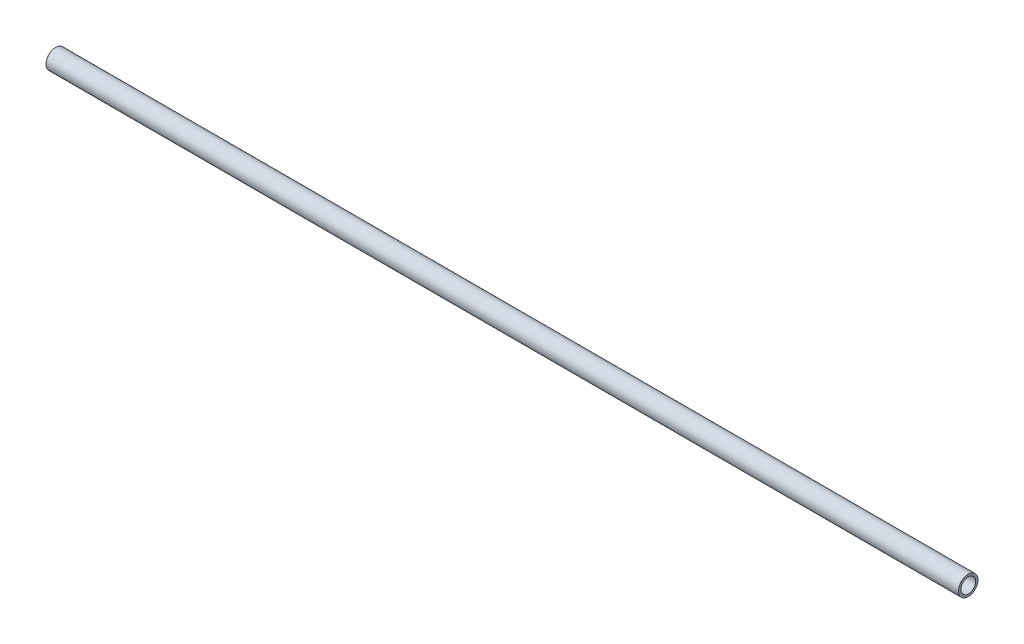
from build123d import *

# Parameters (mm, degrees)
SKETCH1_R           = 12.7
SKETCH1_R_2         = 9.652
BOSS_EXTRUDE1_DEPTH = 1190


with BuildPart() as part:
    # Sketch1 → Boss-Extrude1 (new body)
    with BuildSketch(Plane(origin=(0, 0, 0), x_dir=(0, 0, -1), z_dir=(1, 0, 0))):
        Circle(SKETCH1_R)
        Circle(SKETCH1_R_2, mode=Mode.SUBTRACT)
    extrude(amount=BOSS_EXTRUDE1_DEPTH)


solid = part.part
